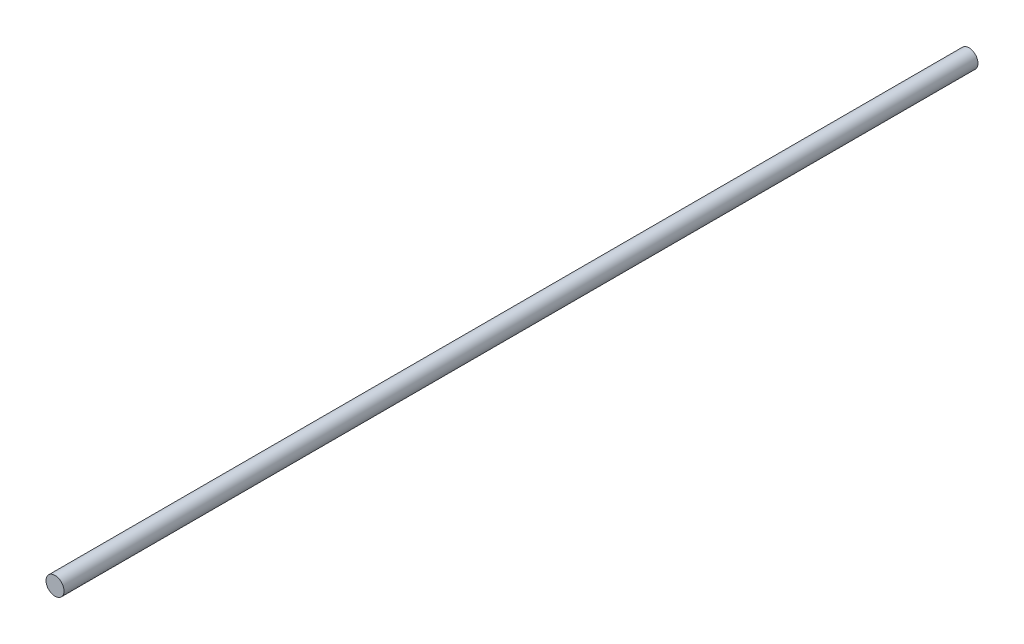
from build123d import *

# Parameters (mm, degrees)
SKETCH1_R           = 4
BOSS_EXTRUDE1_DEPTH = 405


with BuildPart() as part:
    # Sketch1 → Boss-Extrude1 (new body)
    with BuildSketch(Plane.XY):
        Circle(SKETCH1_R)
    extrude(amount=BOSS_EXTRUDE1_DEPTH)


solid = part.part
